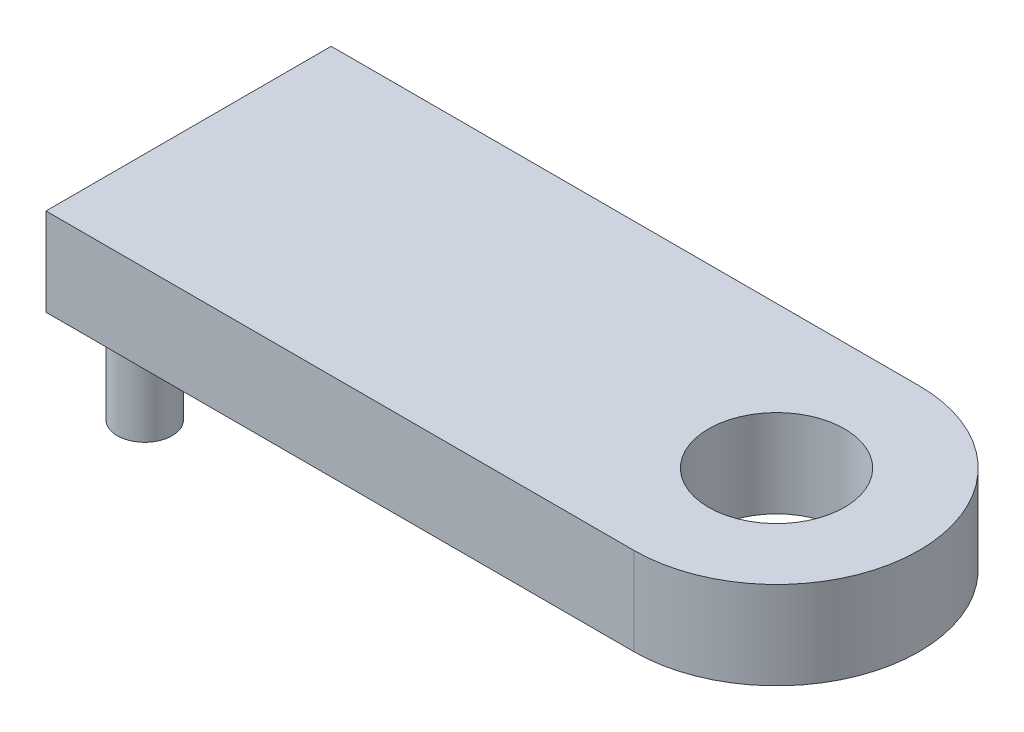
from build123d import *

# Parameters (mm, degrees)
BOSS_EXTRUDE1_DEPTH = 4
SKETCH2_R           = 3.1
CUT_EXTRUDE2_DEPTH  = 4
SKETCH3_R           = 1.25
BOSS_EXTRUDE2_DEPTH = 4


with BuildPart() as part:
    # Sketch1 → Boss-Extrude1 (new body)
    with BuildSketch(Plane(origin=(0, 23.1, 0), x_dir=(1, 0, 0), z_dir=(0, 1, 0))):
        with BuildLine():
            Line((5.5, 6.5), (-21.3, 6.5))
            Line((-21.3, 6.5), (-21.3, -6.5))
            Line((-21.3, -6.5), (5.5, -6.5))
            ThreePointArc((5.5, -6.5), (12, 0), (5.5, 6.5))
        make_face()
    extrude(amount=BOSS_EXTRUDE1_DEPTH)

    # Sketch2 → Cut-Extrude2 (cut)
    with BuildSketch(Plane(origin=(0, 23.1, 0), x_dir=(1, 0, 0), z_dir=(0, 1, 0))):
        with Locations(Location((5.5, 0, 0), (0, 0, 270))):
            Circle(SKETCH2_R)
    extrude(amount=CUT_EXTRUDE2_DEPTH, mode=Mode.SUBTRACT)

    # Sketch3 → Boss-Extrude2 (add)
    with BuildSketch(Plane(origin=(0, 19.1, 0), x_dir=(1, 0, 0), z_dir=(0, 1, 0))):
        with Locations(Location((-18.8, -4.5, 0), (0, 0, 270))):
            Circle(SKETCH3_R)
        with Locations(Location((-18.8, 4.5, 0), (0, 0, 270))):
            Circle(SKETCH3_R)
    extrude(amount=BOSS_EXTRUDE2_DEPTH)


solid = part.part
